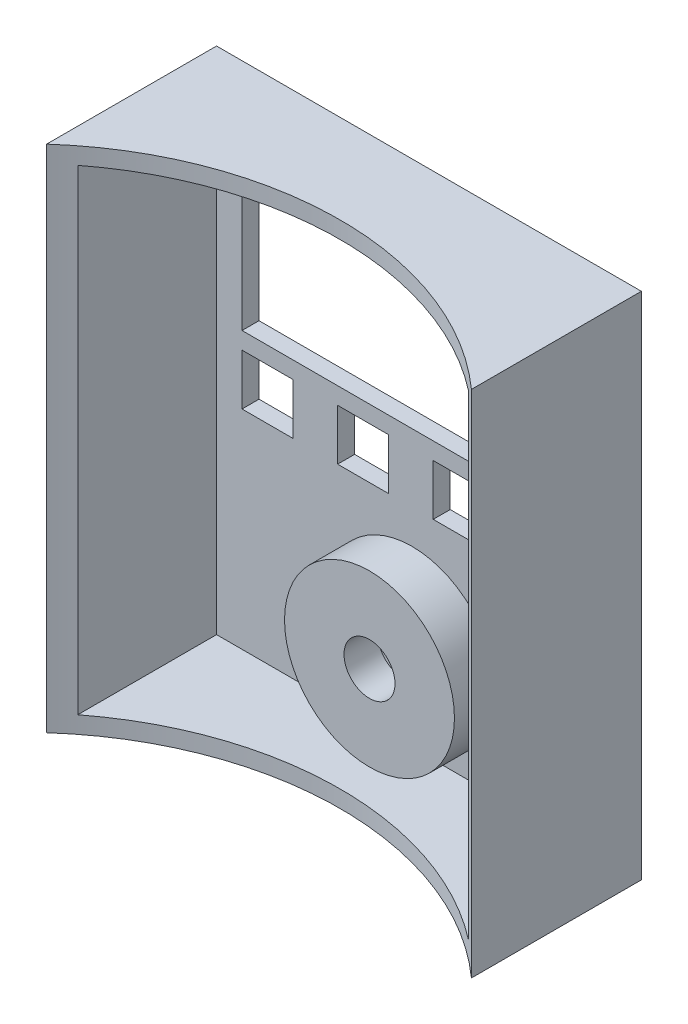
from build123d import *

# Parameters (mm, degrees)
SKETCH1_W                    = 100
SKETCH1_H                    = 120
BOSS_EXTRUDE1_DEPTH          = 40
CUT_EXTRUDE2_DEPTH           = 120
SHELL1_T                     = -4
CUT_EXTRUDE3_DEPTH           = 162.245154966
CUT_EXTRUDE3_DEPTH_BACK      = 162.245154966
SKETCH3_W                    = 80
SKETCH3_H                    = 36
SKETCH4_R                    = 20
BOSS_EXTRUDE2_DEPTH          = 10
SKETCH6_W                    = 45
SKETCH6_H                    = 6
BOSS_EXTRUDE4_DEPTH          = 8
SKETCH7_R                    = 2.5
CUT_EXTRUDE6_DEPTH           = 159.694675399
LPATTERN2_COUNT              = 2
LPATTERN2_PITCH              = 15
LPATTERN2_COL_COUNT          = 2
LPATTERN2_COL_PITCH          = 15
SKETCH9_W                    = 12
SKETCH9_H                    = 12
CUT_EXTRUDE7_DEPTH           = 10
LPATTERN3_COUNT              = 4
LPATTERN3_PITCH              = 22.5
SKETCH10_R                   = 6
CUT_EXTRUDE8_DEPTH           = 8
SKETCH13_R                   = 0.5
CUT_EXTRUDE9_DEPTH           = 10
LPATTERN4_COUNT              = 3
LPATTERN4_PITCH              = 2
LPATTERN4_COL_COUNT          = 3
LPATTERN4_COL_PITCH          = 2
CIRPATTERN2_COPY_1_SKETCH_R  = 0.5
CIRPATTERN2_COPY_1_DEPTH     = 10
CIRPATTERN2_COPY_2_SKETCH_R  = 0.5
CIRPATTERN2_COPY_2_DEPTH     = 10
CIRPATTERN2_COPY_3_SKETCH_R  = 0.5
CIRPATTERN2_COPY_3_DEPTH     = 10
CIRPATTERN2_COPY_4_SKETCH_R  = 0.5
CIRPATTERN2_COPY_4_DEPTH     = 10
CIRPATTERN2_COPY_5_SKETCH_R  = 0.5
CIRPATTERN2_COPY_5_DEPTH     = 10
CIRPATTERN2_COPY_6_SKETCH_R  = 0.5
CIRPATTERN2_COPY_6_DEPTH     = 10
CIRPATTERN2_COPY_7_SKETCH_R  = 0.5
CIRPATTERN2_COPY_7_DEPTH     = 10
CIRPATTERN2_COPY_8_SKETCH_R  = 0.5
CIRPATTERN2_COPY_8_DEPTH     = 10
CIRPATTERN2_COPY_9_SKETCH_R  = 0.5
CIRPATTERN2_COPY_9_DEPTH     = 10
CIRPATTERN2_COPY_10_SKETCH_R = 0.5
CIRPATTERN2_COPY_10_DEPTH    = 10
CIRPATTERN2_COPY_11_SKETCH_R = 0.5
CIRPATTERN2_COPY_11_DEPTH    = 10
CIRPATTERN2_COPY_12_SKETCH_R = 0.5
CIRPATTERN2_COPY_12_DEPTH    = 10
CIRPATTERN2_COPY_13_SKETCH_R = 0.5
CIRPATTERN2_COPY_13_DEPTH    = 10
CIRPATTERN2_COPY_14_SKETCH_R = 0.5
CIRPATTERN2_COPY_14_DEPTH    = 10
CIRPATTERN2_COPY_15_SKETCH_R = 0.5
CIRPATTERN2_COPY_15_DEPTH    = 10
CIRPATTERN2_COPY_16_SKETCH_R = 0.5
CIRPATTERN2_COPY_16_DEPTH    = 10
CIRPATTERN2_COPY_17_SKETCH_R = 0.5
CIRPATTERN2_COPY_17_DEPTH    = 10
CIRPATTERN2_COPY_18_SKETCH_R = 0.5
CIRPATTERN2_COPY_18_DEPTH    = 10
CIRPATTERN2_COPY_19_SKETCH_R = 0.5
CIRPATTERN2_COPY_19_DEPTH    = 10
CIRPATTERN2_COPY_20_SKETCH_R = 0.5
CIRPATTERN2_COPY_20_DEPTH    = 10
CIRPATTERN2_COPY_21_SKETCH_R = 0.5
CIRPATTERN2_COPY_21_DEPTH    = 10
CIRPATTERN2_COPY_22_SKETCH_R = 0.5
CIRPATTERN2_COPY_22_DEPTH    = 10
CIRPATTERN2_COPY_23_SKETCH_R = 0.5
CIRPATTERN2_COPY_23_DEPTH    = 10
CIRPATTERN2_COPY_24_SKETCH_R = 0.5
CIRPATTERN2_COPY_24_DEPTH    = 10
CIRPATTERN2_COPY_25_SKETCH_R = 0.5
CIRPATTERN2_COPY_25_DEPTH    = 10


with BuildPart() as part:
    # Sketch1 → Boss-Extrude1 (new body)
    with BuildSketch(Plane.XY):
        with Locations((50, -60)):
            Rectangle(SKETCH1_W, SKETCH1_H)
    extrude(amount=BOSS_EXTRUDE1_DEPTH)

    # Sketch2 → Cut-Extrude2 (cut)
    with BuildSketch(Plane(origin=(0, 0, 0), x_dir=(1, 0, 0), z_dir=(0, 1, 0))):
        with BuildLine():
            Line((0, -40), (100, -40))
            ThreePointArc((100, -40), (50, -20.901699437), (0, -40))
        make_face()
    extrude(amount=-CUT_EXTRUDE2_DEPTH, mode=Mode.SUBTRACT)

    # Shell1
    shell1_openings = [part.faces().sort_by_distance(p)[0] for p in [
        (50, -60, 20.901699437),
    ]]
    offset(amount=SHELL1_T, openings=shell1_openings, kind=Kind.INTERSECTION)

    # Sketch3 → Cut-Extrude3 (cut, two sides: drawn at the far end of the back side and taken through both)
    with BuildSketch(Plane(origin=(0, 0, 0), x_dir=(-1, 0, 0), z_dir=(0, 0, -1)).offset(-CUT_EXTRUDE3_DEPTH_BACK)):
        with Locations((-50, -33)):
            Rectangle(SKETCH3_W, SKETCH3_H)
    extrude(amount=CUT_EXTRUDE3_DEPTH + CUT_EXTRUDE3_DEPTH_BACK, mode=Mode.SUBTRACT)

    # Sketch4 → Boss-Extrude2 (add)
    with BuildSketch(Plane.XY.offset(4)):
        with Locations((50, -95)):
            Circle(SKETCH4_R)
    extrude(amount=BOSS_EXTRUDE2_DEPTH)

    # Sketch6 → Boss-Extrude4 (add)
    with BuildSketch(Plane.XY.offset(4)):
        with Locations((50, -9)):
            Rectangle(SKETCH6_W, SKETCH6_H)
    extrude(amount=BOSS_EXTRUDE4_DEPTH)

    # Sketch7 → Cut-Extrude6 (cut, through all)
    with BuildSketch(Plane.XY.offset(12)):
        with Locations((50, -9)):
            Circle(SKETCH7_R)
    cut_extrude6 = extrude(amount=-CUT_EXTRUDE6_DEPTH, mode=Mode.SUBTRACT)

    # LPattern2: Cut-Extrude6 ×2
    with Locations(*[(-i * LPATTERN2_PITCH, 0, 0) for i in range(1, LPATTERN2_COUNT)]):
        add(cut_extrude6, mode=Mode.SUBTRACT)

    # LPattern2 col: Cut-Extrude6 ×2
    with Locations(*[(i * LPATTERN2_COL_PITCH, 0, 0) for i in range(1, LPATTERN2_COL_COUNT)]):
        add(cut_extrude6, mode=Mode.SUBTRACT)

    # Sketch9 → Cut-Extrude7 (cut)
    with BuildSketch(Plane.XY.offset(4)):
        with Locations((16, -61)):
            Rectangle(SKETCH9_W, SKETCH9_H)
    cut_extrude7 = extrude(amount=-CUT_EXTRUDE7_DEPTH, mode=Mode.SUBTRACT)

    # LPattern3: Cut-Extrude7 ×4
    with Locations(*[(i * LPATTERN3_PITCH, 0, 0) for i in range(1, LPATTERN3_COUNT)]):
        add(cut_extrude7, mode=Mode.SUBTRACT)

    # Sketch10 → Cut-Extrude8 (cut)
    with BuildSketch(Plane.XY.offset(14)):
        with Locations((50, -95)):
            Circle(SKETCH10_R)
    extrude(amount=-CUT_EXTRUDE8_DEPTH, mode=Mode.SUBTRACT)

    # Sketch13 → Cut-Extrude9 (cut)
    with BuildSketch(Plane.XY.offset(6)):
        with Locations((50, -95)):
            Circle(SKETCH13_R)
    cut_extrude9 = extrude(amount=-CUT_EXTRUDE9_DEPTH, mode=Mode.SUBTRACT)

    # LPattern4: Cut-Extrude9 ×3
    with Locations(*[(i * LPATTERN4_PITCH, 0, 0) for i in range(1, LPATTERN4_COUNT)]):
        add(cut_extrude9, mode=Mode.SUBTRACT)

    # LPattern4 col: Cut-Extrude9 ×3
    with Locations(*[(-i * LPATTERN4_COL_PITCH, 0, 0) for i in range(1, LPATTERN4_COL_COUNT)]):
        add(cut_extrude9, mode=Mode.SUBTRACT)

    # CirPattern2 copy 1 sketch → CirPattern2 copy 1 (cut)
    with BuildSketch(Plane(origin=(-56.27241336, -89.069219382, 6), x_dir=(0.5000000000000001, 0.8660254037844386, 0), z_dir=(0, 0, 1))):
        with Locations((50, -95)):
            Circle(CIRPATTERN2_COPY_1_SKETCH_R)
    extrude(amount=-CIRPATTERN2_COPY_1_DEPTH, mode=Mode.SUBTRACT)

    # CirPattern2 copy 2 sketch → CirPattern2 copy 2 (cut)
    with BuildSketch(Plane(origin=(-8.27241336, -184.069219382, 6), x_dir=(-0.4999999999999998, 0.8660254037844387, 0), z_dir=(0, 0, 1))):
        with Locations((50, -95)):
            Circle(CIRPATTERN2_COPY_2_SKETCH_R)
    extrude(amount=-CIRPATTERN2_COPY_2_DEPTH, mode=Mode.SUBTRACT)

    # CirPattern2 copy 3 sketch → CirPattern2 copy 3 (cut)
    with BuildSketch(Plane(origin=(98, -190, 6), x_dir=(-1, 0, 0), z_dir=(0, 0, 1))):
        with Locations((50, -95)):
            Circle(CIRPATTERN2_COPY_3_SKETCH_R)
    extrude(amount=-CIRPATTERN2_COPY_3_DEPTH, mode=Mode.SUBTRACT)

    # CirPattern2 copy 4 sketch → CirPattern2 copy 4 (cut)
    with BuildSketch(Plane(origin=(156.27241336, -100.930780618, 6), x_dir=(-0.5000000000000004, -0.8660254037844384, 0), z_dir=(0, 0, 1))):
        with Locations((50, -95)):
            Circle(CIRPATTERN2_COPY_4_SKETCH_R)
    extrude(amount=-CIRPATTERN2_COPY_4_DEPTH, mode=Mode.SUBTRACT)

    # CirPattern2 copy 5 sketch → CirPattern2 copy 5 (cut)
    with BuildSketch(Plane(origin=(108.27241336, -5.930780618, 6), x_dir=(0.5000000000000001, -0.8660254037844386, 0), z_dir=(0, 0, 1))):
        with Locations((50, -95)):
            Circle(CIRPATTERN2_COPY_5_SKETCH_R)
    extrude(amount=-CIRPATTERN2_COPY_5_DEPTH, mode=Mode.SUBTRACT)

    # CirPattern2 copy 6 sketch → CirPattern2 copy 6 (cut)
    with BuildSketch(Plane(origin=(-55.27241336, -87.337168574, 6), x_dir=(0.5000000000000001, 0.8660254037844386, 0), z_dir=(0, 0, 1))):
        with Locations((50, -95)):
            Circle(CIRPATTERN2_COPY_6_SKETCH_R)
    extrude(amount=-CIRPATTERN2_COPY_6_DEPTH, mode=Mode.SUBTRACT)

    # CirPattern2 copy 7 sketch → CirPattern2 copy 7 (cut)
    with BuildSketch(Plane(origin=(-9.27241336, -182.337168574, 6), x_dir=(-0.4999999999999998, 0.8660254037844387, 0), z_dir=(0, 0, 1))):
        with Locations((50, -95)):
            Circle(CIRPATTERN2_COPY_7_SKETCH_R)
    extrude(amount=-CIRPATTERN2_COPY_7_DEPTH, mode=Mode.SUBTRACT)

    # CirPattern2 copy 8 sketch → CirPattern2 copy 8 (cut)
    with BuildSketch(Plane(origin=(96, -190, 6), x_dir=(-1, 0, 0), z_dir=(0, 0, 1))):
        with Locations((50, -95)):
            Circle(CIRPATTERN2_COPY_8_SKETCH_R)
    extrude(amount=-CIRPATTERN2_COPY_8_DEPTH, mode=Mode.SUBTRACT)

    # CirPattern2 copy 9 sketch → CirPattern2 copy 9 (cut)
    with BuildSketch(Plane(origin=(155.27241336, -102.662831426, 6), x_dir=(-0.5000000000000004, -0.8660254037844384, 0), z_dir=(0, 0, 1))):
        with Locations((50, -95)):
            Circle(CIRPATTERN2_COPY_9_SKETCH_R)
    extrude(amount=-CIRPATTERN2_COPY_9_DEPTH, mode=Mode.SUBTRACT)

    # CirPattern2 copy 10 sketch → CirPattern2 copy 10 (cut)
    with BuildSketch(Plane(origin=(109.27241336, -7.662831426, 6), x_dir=(0.5000000000000001, -0.8660254037844386, 0), z_dir=(0, 0, 1))):
        with Locations((50, -95)):
            Circle(CIRPATTERN2_COPY_10_SKETCH_R)
    extrude(amount=-CIRPATTERN2_COPY_10_DEPTH, mode=Mode.SUBTRACT)

    # CirPattern2 copy 11 sketch → CirPattern2 copy 11 (cut)
    with BuildSketch(Plane(origin=(-58.27241336, -92.533320997, 6), x_dir=(0.5000000000000001, 0.8660254037844386, 0), z_dir=(0, 0, 1))):
        with Locations((50, -95)):
            Circle(CIRPATTERN2_COPY_11_SKETCH_R)
    extrude(amount=-CIRPATTERN2_COPY_11_DEPTH, mode=Mode.SUBTRACT)

    # CirPattern2 copy 12 sketch → CirPattern2 copy 12 (cut)
    with BuildSketch(Plane(origin=(-6.27241336, -187.533320997, 6), x_dir=(-0.4999999999999998, 0.8660254037844387, 0), z_dir=(0, 0, 1))):
        with Locations((50, -95)):
            Circle(CIRPATTERN2_COPY_12_SKETCH_R)
    extrude(amount=-CIRPATTERN2_COPY_12_DEPTH, mode=Mode.SUBTRACT)

    # CirPattern2 copy 13 sketch → CirPattern2 copy 13 (cut)
    with BuildSketch(Plane(origin=(102, -190, 6), x_dir=(-1, 0, 0), z_dir=(0, 0, 1))):
        with Locations((50, -95)):
            Circle(CIRPATTERN2_COPY_13_SKETCH_R)
    extrude(amount=-CIRPATTERN2_COPY_13_DEPTH, mode=Mode.SUBTRACT)

    # CirPattern2 copy 14 sketch → CirPattern2 copy 14 (cut)
    with BuildSketch(Plane(origin=(158.27241336, -97.466679003, 6), x_dir=(-0.5000000000000004, -0.8660254037844384, 0), z_dir=(0, 0, 1))):
        with Locations((50, -95)):
            Circle(CIRPATTERN2_COPY_14_SKETCH_R)
    extrude(amount=-CIRPATTERN2_COPY_14_DEPTH, mode=Mode.SUBTRACT)

    # CirPattern2 copy 15 sketch → CirPattern2 copy 15 (cut)
    with BuildSketch(Plane(origin=(106.27241336, -2.466679003, 6), x_dir=(0.5000000000000001, -0.8660254037844386, 0), z_dir=(0, 0, 1))):
        with Locations((50, -95)):
            Circle(CIRPATTERN2_COPY_15_SKETCH_R)
    extrude(amount=-CIRPATTERN2_COPY_15_DEPTH, mode=Mode.SUBTRACT)

    # CirPattern2 copy 16 sketch → CirPattern2 copy 16 (cut)
    with BuildSketch(Plane(origin=(-59.27241336, -94.265371804, 6), x_dir=(0.5000000000000001, 0.8660254037844386, 0), z_dir=(0, 0, 1))):
        with Locations((50, -95)):
            Circle(CIRPATTERN2_COPY_16_SKETCH_R)
    extrude(amount=-CIRPATTERN2_COPY_16_DEPTH, mode=Mode.SUBTRACT)

    # CirPattern2 copy 17 sketch → CirPattern2 copy 17 (cut)
    with BuildSketch(Plane(origin=(-5.27241336, -189.265371804, 6), x_dir=(-0.4999999999999998, 0.8660254037844387, 0), z_dir=(0, 0, 1))):
        with Locations((50, -95)):
            Circle(CIRPATTERN2_COPY_17_SKETCH_R)
    extrude(amount=-CIRPATTERN2_COPY_17_DEPTH, mode=Mode.SUBTRACT)

    # CirPattern2 copy 18 sketch → CirPattern2 copy 18 (cut)
    with BuildSketch(Plane(origin=(104, -190, 6), x_dir=(-1, 0, 0), z_dir=(0, 0, 1))):
        with Locations((50, -95)):
            Circle(CIRPATTERN2_COPY_18_SKETCH_R)
    extrude(amount=-CIRPATTERN2_COPY_18_DEPTH, mode=Mode.SUBTRACT)

    # CirPattern2 copy 19 sketch → CirPattern2 copy 19 (cut)
    with BuildSketch(Plane(origin=(159.27241336, -95.734628196, 6), x_dir=(-0.5000000000000004, -0.8660254037844384, 0), z_dir=(0, 0, 1))):
        with Locations((50, -95)):
            Circle(CIRPATTERN2_COPY_19_SKETCH_R)
    extrude(amount=-CIRPATTERN2_COPY_19_DEPTH, mode=Mode.SUBTRACT)

    # CirPattern2 copy 20 sketch → CirPattern2 copy 20 (cut)
    with BuildSketch(Plane(origin=(105.27241336, -0.734628196, 6), x_dir=(0.5000000000000001, -0.8660254037844386, 0), z_dir=(0, 0, 1))):
        with Locations((50, -95)):
            Circle(CIRPATTERN2_COPY_20_SKETCH_R)
    extrude(amount=-CIRPATTERN2_COPY_20_DEPTH, mode=Mode.SUBTRACT)

    # CirPattern2 copy 21 sketch → CirPattern2 copy 21 (cut)
    with BuildSketch(Plane(origin=(-57.27241336, -90.801270189, 6), x_dir=(0.5000000000000001, 0.8660254037844386, 0), z_dir=(0, 0, 1))):
        with Locations((50, -95)):
            Circle(CIRPATTERN2_COPY_21_SKETCH_R)
    extrude(amount=-CIRPATTERN2_COPY_21_DEPTH, mode=Mode.SUBTRACT)

    # CirPattern2 copy 22 sketch → CirPattern2 copy 22 (cut)
    with BuildSketch(Plane(origin=(-7.27241336, -185.801270189, 6), x_dir=(-0.4999999999999998, 0.8660254037844387, 0), z_dir=(0, 0, 1))):
        with Locations((50, -95)):
            Circle(CIRPATTERN2_COPY_22_SKETCH_R)
    extrude(amount=-CIRPATTERN2_COPY_22_DEPTH, mode=Mode.SUBTRACT)

    # CirPattern2 copy 23 sketch → CirPattern2 copy 23 (cut)
    with BuildSketch(Plane(origin=(100, -190, 6), x_dir=(-1, 0, 0), z_dir=(0, 0, 1))):
        with Locations((50, -95)):
            Circle(CIRPATTERN2_COPY_23_SKETCH_R)
    extrude(amount=-CIRPATTERN2_COPY_23_DEPTH, mode=Mode.SUBTRACT)

    # CirPattern2 copy 24 sketch → CirPattern2 copy 24 (cut)
    with BuildSketch(Plane(origin=(157.27241336, -99.198729811, 6), x_dir=(-0.5000000000000004, -0.8660254037844384, 0), z_dir=(0, 0, 1))):
        with Locations((50, -95)):
            Circle(CIRPATTERN2_COPY_24_SKETCH_R)
    extrude(amount=-CIRPATTERN2_COPY_24_DEPTH, mode=Mode.SUBTRACT)

    # CirPattern2 copy 25 sketch → CirPattern2 copy 25 (cut)
    with BuildSketch(Plane(origin=(107.27241336, -4.198729811, 6), x_dir=(0.5000000000000001, -0.8660254037844386, 0), z_dir=(0, 0, 1))):
        with Locations((50, -95)):
            Circle(CIRPATTERN2_COPY_25_SKETCH_R)
    extrude(amount=-CIRPATTERN2_COPY_25_DEPTH, mode=Mode.SUBTRACT)


solid = part.part
